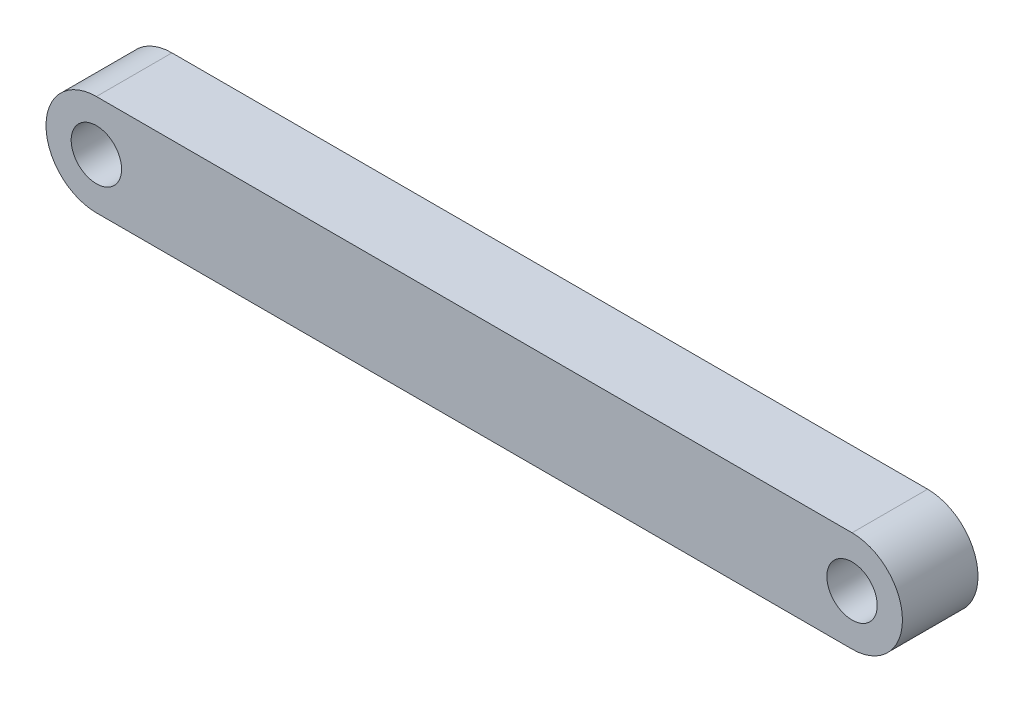
from build123d import *

# Parameters (mm, degrees)
ESQUISSE1_R        = 1
BOSS_EXTRU_1_DEPTH = 3


with BuildPart() as part:
    # Esquisse1 → Boss.-Extru.1 (new body)
    with BuildSketch(Plane.XY):
        with BuildLine():
            Line((-15, 2), (15, 2))
            ThreePointArc((15, 2), (17, 0), (15, -2))
            Line((15, -2), (-15, -2))
            ThreePointArc((-15, -2), (-17, 0), (-15, 2))
        make_face()
        with Locations((-15, 0)):
            Circle(ESQUISSE1_R, mode=Mode.SUBTRACT)
        with Locations((15, 0)):
            Circle(ESQUISSE1_R, mode=Mode.SUBTRACT)
    extrude(amount=BOSS_EXTRU_1_DEPTH)


solid = part.part
